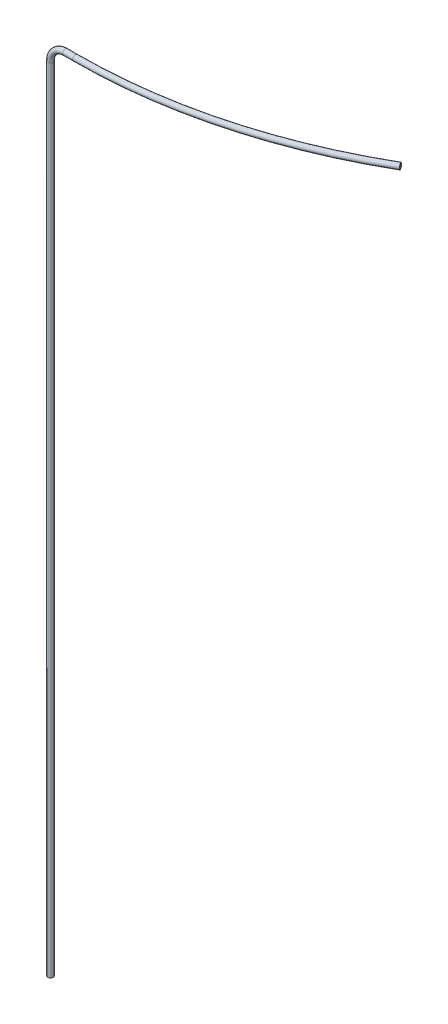
from build123d import *

# Parameters (mm, degrees)
SKETCH_1_R      = 6
SKETCH_1_R_2    = 4
REVOLVE_1_ANGLE = 30
SKETCH_2_R      = 15
SKETCH_2_R_2    = 10
SKETCH_2_R_3    = 6
SKETCH_2_R_4    = 4
SKETCH_11_R     = 6
SKETCH_11_R_2   = 4
EXTRUDE_1_DEPTH = 800


with BuildPart() as part:
    # 草图1 → 旋转1 (revolve)
    with BuildSketch(Plane(origin=(0, 0, 0), x_dir=(0, 0, -1), z_dir=(1, 0, 0))):
        with Locations((1300, -0.371055822)):
            Circle(SKETCH_1_R)
        with Locations((1300, -0.371055822)):
            Circle(SKETCH_1_R_2, mode=Mode.SUBTRACT)
    revolve(axis=Axis((0, 0, -2400), (0, 1, 0)), revolution_arc=REVOLVE_1_ANGLE)

    # 扫描1: sweep along a path in 草图3
    with BuildLine(Plane.YX.offset(500)) as sweep_1_path:
        Line((0, 0), (0, -21.341132523))
        ThreePointArc((0, -21.341132523), (-9.589995058, -44.493428655), (-32.742291189, -54.083423712))
        Line((-32.742291189, -54.083423712), (-932.742291189, -54.083423712))
    # 草图2 → 扫描1 (sweep)
    # profile 1 of 2: a face of its own
    with BuildSketch(Plane.ZY):
        with Locations((-500, -0.371055822)):
            Circle(SKETCH_2_R)
        with Locations((-500, -0.371055822)):
            Circle(SKETCH_2_R_2, mode=Mode.SUBTRACT)
    # profile 2 of 2: a face of its own
    with BuildSketch(Plane.ZY):
        with Locations((-1300, -0.371055822)):
            Circle(SKETCH_2_R_3)
        with Locations((-1300, -0.371055822)):
            Circle(SKETCH_2_R_4, mode=Mode.SUBTRACT)
    sweep(path=sweep_1_path.line)


with BuildPart() as sweep_1_kept_piece:
    # of the separate pieces the step leaves, the one the design keeps (sweep_1_pieces_kept)
    add(part.part.solids().sort_by_distance((0, -0.371055822, -1306))[0])

    # 草图11 → 凸台-拉伸1 (add)
    with BuildSketch(Plane.XZ.offset(932.742291189)):
        with Locations((-53.712367891, -1300)):
            Circle(SKETCH_11_R)
        with Locations((-53.712367891, -1300)):
            Circle(SKETCH_11_R_2, mode=Mode.SUBTRACT)
    extrude(amount=EXTRUDE_1_DEPTH)


solid = sweep_1_kept_piece.part
